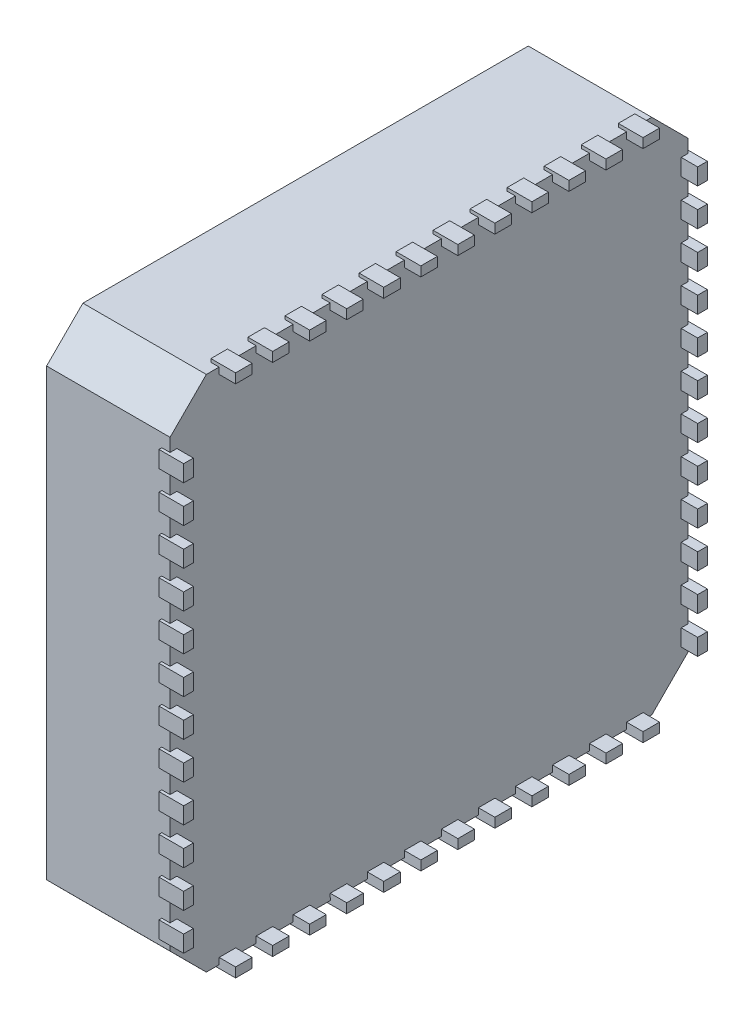
from build123d import *

# Parameters (mm, degrees)
BOSS_EXTRUDE1_DEPTH         = 1.5
BOSS_EXTRUDE2_DEPTH         = 0.2
BOSS_EXTRUDE2_DEPTH_BACK    = 0.1
SKETCH3_W                   = 0.201171233
SKETCH3_H                   = 0.116462587
BOSS_EXTRUDE2_2_DEPTH       = 0.2
BOSS_EXTRUDE2_2_DEPTH_BACK  = 0.1
BOSS_EXTRUDE2_3_DEPTH       = 0.2
BOSS_EXTRUDE2_3_DEPTH_BACK  = 0.1
BOSS_EXTRUDE2_4_DEPTH       = 0.2
BOSS_EXTRUDE2_4_DEPTH_BACK  = 0.1
BOSS_EXTRUDE2_5_DEPTH       = 0.2
BOSS_EXTRUDE2_5_DEPTH_BACK  = 0.1
BOSS_EXTRUDE2_6_DEPTH       = 0.2
BOSS_EXTRUDE2_6_DEPTH_BACK  = 0.1
BOSS_EXTRUDE2_7_DEPTH       = 0.2
BOSS_EXTRUDE2_7_DEPTH_BACK  = 0.1
BOSS_EXTRUDE2_8_DEPTH       = 0.2
BOSS_EXTRUDE2_8_DEPTH_BACK  = 0.1
BOSS_EXTRUDE2_9_DEPTH       = 0.2
BOSS_EXTRUDE2_9_DEPTH_BACK  = 0.1
BOSS_EXTRUDE2_10_DEPTH      = 0.2
BOSS_EXTRUDE2_10_DEPTH_BACK = 0.1
BOSS_EXTRUDE2_11_DEPTH      = 0.2
BOSS_EXTRUDE2_11_DEPTH_BACK = 0.1
BOSS_EXTRUDE2_12_DEPTH      = 0.2
BOSS_EXTRUDE2_12_DEPTH_BACK = 0.1
BOSS_EXTRUDE2_13_DEPTH      = 0.2
BOSS_EXTRUDE2_13_DEPTH_BACK = 0.1
BOSS_EXTRUDE2_14_DEPTH      = 0.2
BOSS_EXTRUDE2_14_DEPTH_BACK = 0.1
BOSS_EXTRUDE2_15_DEPTH      = 0.2
BOSS_EXTRUDE2_15_DEPTH_BACK = 0.1
BOSS_EXTRUDE2_16_DEPTH      = 0.2
BOSS_EXTRUDE2_16_DEPTH_BACK = 0.1
BOSS_EXTRUDE2_17_DEPTH      = 0.2
BOSS_EXTRUDE2_17_DEPTH_BACK = 0.1
BOSS_EXTRUDE2_18_DEPTH      = 0.2
BOSS_EXTRUDE2_18_DEPTH_BACK = 0.1
BOSS_EXTRUDE2_19_DEPTH      = 0.2
BOSS_EXTRUDE2_19_DEPTH_BACK = 0.1
BOSS_EXTRUDE2_20_DEPTH      = 0.2
BOSS_EXTRUDE2_20_DEPTH_BACK = 0.1
BOSS_EXTRUDE2_21_DEPTH      = 0.2
BOSS_EXTRUDE2_21_DEPTH_BACK = 0.1
BOSS_EXTRUDE2_22_DEPTH      = 0.2
BOSS_EXTRUDE2_22_DEPTH_BACK = 0.1
BOSS_EXTRUDE2_23_DEPTH      = 0.2
BOSS_EXTRUDE2_23_DEPTH_BACK = 0.1
BOSS_EXTRUDE2_24_DEPTH      = 0.2
BOSS_EXTRUDE2_24_DEPTH_BACK = 0.1
BOSS_EXTRUDE2_25_DEPTH      = 0.2
BOSS_EXTRUDE2_25_DEPTH_BACK = 0.1
SKETCH3_W_2                 = 0.118473401
SKETCH3_H_2                 = 0.202033004
BOSS_EXTRUDE2_26_DEPTH      = 0.2
BOSS_EXTRUDE2_26_DEPTH_BACK = 0.1
BOSS_EXTRUDE2_27_DEPTH      = 0.2
BOSS_EXTRUDE2_27_DEPTH_BACK = 0.1
BOSS_EXTRUDE2_28_DEPTH      = 0.2
BOSS_EXTRUDE2_28_DEPTH_BACK = 0.1
BOSS_EXTRUDE2_29_DEPTH      = 0.2
BOSS_EXTRUDE2_29_DEPTH_BACK = 0.1
BOSS_EXTRUDE2_30_DEPTH      = 0.2
BOSS_EXTRUDE2_30_DEPTH_BACK = 0.1
BOSS_EXTRUDE2_31_DEPTH      = 0.2
BOSS_EXTRUDE2_31_DEPTH_BACK = 0.1
BOSS_EXTRUDE2_32_DEPTH      = 0.2
BOSS_EXTRUDE2_32_DEPTH_BACK = 0.1
BOSS_EXTRUDE2_33_DEPTH      = 0.2
BOSS_EXTRUDE2_33_DEPTH_BACK = 0.1
BOSS_EXTRUDE2_34_DEPTH      = 0.2
BOSS_EXTRUDE2_34_DEPTH_BACK = 0.1
BOSS_EXTRUDE2_35_DEPTH      = 0.2
BOSS_EXTRUDE2_35_DEPTH_BACK = 0.1
BOSS_EXTRUDE2_36_DEPTH      = 0.2
BOSS_EXTRUDE2_36_DEPTH_BACK = 0.1
BOSS_EXTRUDE2_37_DEPTH      = 0.2
BOSS_EXTRUDE2_37_DEPTH_BACK = 0.1
BOSS_EXTRUDE2_38_DEPTH      = 0.2
BOSS_EXTRUDE2_38_DEPTH_BACK = 0.1
BOSS_EXTRUDE2_39_DEPTH      = 0.2
BOSS_EXTRUDE2_39_DEPTH_BACK = 0.1
BOSS_EXTRUDE2_40_DEPTH      = 0.2
BOSS_EXTRUDE2_40_DEPTH_BACK = 0.1
BOSS_EXTRUDE2_41_DEPTH      = 0.2
BOSS_EXTRUDE2_41_DEPTH_BACK = 0.1
BOSS_EXTRUDE2_42_DEPTH      = 0.2
BOSS_EXTRUDE2_42_DEPTH_BACK = 0.1
BOSS_EXTRUDE2_43_DEPTH      = 0.2
BOSS_EXTRUDE2_43_DEPTH_BACK = 0.1
BOSS_EXTRUDE2_44_DEPTH      = 0.2
BOSS_EXTRUDE2_44_DEPTH_BACK = 0.1
BOSS_EXTRUDE2_45_DEPTH      = 0.2
BOSS_EXTRUDE2_45_DEPTH_BACK = 0.1
BOSS_EXTRUDE2_46_DEPTH      = 0.2
BOSS_EXTRUDE2_46_DEPTH_BACK = 0.1
BOSS_EXTRUDE2_47_DEPTH      = 0.2
BOSS_EXTRUDE2_47_DEPTH_BACK = 0.1
BOSS_EXTRUDE2_48_DEPTH      = 0.2
BOSS_EXTRUDE2_48_DEPTH_BACK = 0.1


with BuildPart() as part:
    # Sketch1 → Boss-Extrude1 (new body)
    with BuildSketch(Plane(origin=(0, 0, 0), x_dir=(0, 0, -1), z_dir=(1, 0, 0))):
        Polygon((-2.705745169, 3.144352607), (2.705745169, 3.144352607), (3.146576543, 2.703521232), (3.146576543, -2.703158576), (2.706107824, -3.144352308), (-2.706107824, -3.144352308), (-3.146576543, -2.703158576), (-3.146576543, 2.703521232), align=None)
    extrude(amount=BOSS_EXTRUDE1_DEPTH)


with BuildPart() as body_2:
    # Sketch3 → Boss-Extrude2 (new, two sides: drawn at the far end of the back side and taken through both)
    with BuildSketch(Plane(origin=(1.5, 0, 0), x_dir=(0, 0, -1), z_dir=(1, 0, 0)).offset(-BOSS_EXTRUDE2_DEPTH_BACK)):
        with Locations((-2.000142358, 3.125490057)):
            Rectangle(SKETCH3_W, SKETCH3_H)
    extrude(amount=BOSS_EXTRUDE2_DEPTH + BOSS_EXTRUDE2_DEPTH_BACK)


with BuildPart() as body_3:
    # Sketch3 → Boss-Extrude2 2 (new, two sides: drawn at the far end of the back side and taken through both)
    with BuildSketch(Plane(origin=(1.5, 0, 0), x_dir=(0, 0, -1), z_dir=(1, 0, 0)).offset(-BOSS_EXTRUDE2_2_DEPTH_BACK)):
        with Locations((-2.450142357, 3.125490057)):
            Rectangle(SKETCH3_W, SKETCH3_H)
    extrude(amount=BOSS_EXTRUDE2_2_DEPTH + BOSS_EXTRUDE2_2_DEPTH_BACK)


with BuildPart() as body_4:
    # Sketch3 → Boss-Extrude2 3 (new, two sides: drawn at the far end of the back side and taken through both)
    with BuildSketch(Plane(origin=(1.5, 0, 0), x_dir=(0, 0, -1), z_dir=(1, 0, 0)).offset(-BOSS_EXTRUDE2_3_DEPTH_BACK)):
        with Locations((-1.550142357, 3.125490057)):
            Rectangle(SKETCH3_W, SKETCH3_H)
    extrude(amount=BOSS_EXTRUDE2_3_DEPTH + BOSS_EXTRUDE2_3_DEPTH_BACK)


with BuildPart() as body_5:
    # Sketch3 → Boss-Extrude2 4 (new, two sides: drawn at the far end of the back side and taken through both)
    with BuildSketch(Plane(origin=(1.5, 0, 0), x_dir=(0, 0, -1), z_dir=(1, 0, 0)).offset(-BOSS_EXTRUDE2_4_DEPTH_BACK)):
        with Locations((-1.100142358, 3.125490057)):
            Rectangle(SKETCH3_W, SKETCH3_H)
    extrude(amount=BOSS_EXTRUDE2_4_DEPTH + BOSS_EXTRUDE2_4_DEPTH_BACK)


with BuildPart() as body_6:
    # Sketch3 → Boss-Extrude2 5 (new, two sides: drawn at the far end of the back side and taken through both)
    with BuildSketch(Plane(origin=(1.5, 0, 0), x_dir=(0, 0, -1), z_dir=(1, 0, 0)).offset(-BOSS_EXTRUDE2_5_DEPTH_BACK)):
        with Locations((-0.650142358, 3.125490057)):
            Rectangle(SKETCH3_W, SKETCH3_H)
    extrude(amount=BOSS_EXTRUDE2_5_DEPTH + BOSS_EXTRUDE2_5_DEPTH_BACK)


with BuildPart() as body_7:
    # Sketch3 → Boss-Extrude2 6 (new, two sides: drawn at the far end of the back side and taken through both)
    with BuildSketch(Plane(origin=(1.5, 0, 0), x_dir=(0, 0, -1), z_dir=(1, 0, 0)).offset(-BOSS_EXTRUDE2_6_DEPTH_BACK)):
        with Locations((-0.200142358, 3.125490057)):
            Rectangle(SKETCH3_W, SKETCH3_H)
    extrude(amount=BOSS_EXTRUDE2_6_DEPTH + BOSS_EXTRUDE2_6_DEPTH_BACK)


with BuildPart() as body_8:
    # Sketch3 → Boss-Extrude2 7 (new, two sides: drawn at the far end of the back side and taken through both)
    with BuildSketch(Plane(origin=(1.5, 0, 0), x_dir=(0, 0, -1), z_dir=(1, 0, 0)).offset(-BOSS_EXTRUDE2_7_DEPTH_BACK)):
        with Locations((0.249857643, 3.125490057)):
            Rectangle(SKETCH3_W, SKETCH3_H)
    extrude(amount=BOSS_EXTRUDE2_7_DEPTH + BOSS_EXTRUDE2_7_DEPTH_BACK)


with BuildPart() as body_9:
    # Sketch3 → Boss-Extrude2 8 (new, two sides: drawn at the far end of the back side and taken through both)
    with BuildSketch(Plane(origin=(1.5, 0, 0), x_dir=(0, 0, -1), z_dir=(1, 0, 0)).offset(-BOSS_EXTRUDE2_8_DEPTH_BACK)):
        with Locations((0.699857643, 3.125490057)):
            Rectangle(SKETCH3_W, SKETCH3_H)
    extrude(amount=BOSS_EXTRUDE2_8_DEPTH + BOSS_EXTRUDE2_8_DEPTH_BACK)


with BuildPart() as body_10:
    # Sketch3 → Boss-Extrude2 9 (new, two sides: drawn at the far end of the back side and taken through both)
    with BuildSketch(Plane(origin=(1.5, 0, 0), x_dir=(0, 0, -1), z_dir=(1, 0, 0)).offset(-BOSS_EXTRUDE2_9_DEPTH_BACK)):
        with Locations((1.149857643, 3.125490057)):
            Rectangle(SKETCH3_W, SKETCH3_H)
    extrude(amount=BOSS_EXTRUDE2_9_DEPTH + BOSS_EXTRUDE2_9_DEPTH_BACK)


with BuildPart() as body_11:
    # Sketch3 → Boss-Extrude2 10 (new, two sides: drawn at the far end of the back side and taken through both)
    with BuildSketch(Plane(origin=(1.5, 0, 0), x_dir=(0, 0, -1), z_dir=(1, 0, 0)).offset(-BOSS_EXTRUDE2_10_DEPTH_BACK)):
        with Locations((1.599857642, 3.125490057)):
            Rectangle(SKETCH3_W, SKETCH3_H)
    extrude(amount=BOSS_EXTRUDE2_10_DEPTH + BOSS_EXTRUDE2_10_DEPTH_BACK)


with BuildPart() as body_12:
    # Sketch3 → Boss-Extrude2 11 (new, two sides: drawn at the far end of the back side and taken through both)
    with BuildSketch(Plane(origin=(1.5, 0, 0), x_dir=(0, 0, -1), z_dir=(1, 0, 0)).offset(-BOSS_EXTRUDE2_11_DEPTH_BACK)):
        with Locations((2.049857643, 3.125490057)):
            Rectangle(SKETCH3_W, SKETCH3_H)
    extrude(amount=BOSS_EXTRUDE2_11_DEPTH + BOSS_EXTRUDE2_11_DEPTH_BACK)


with BuildPart() as body_13:
    # Sketch3 → Boss-Extrude2 12 (new, two sides: drawn at the far end of the back side and taken through both)
    with BuildSketch(Plane(origin=(1.5, 0, 0), x_dir=(0, 0, -1), z_dir=(1, 0, 0)).offset(-BOSS_EXTRUDE2_12_DEPTH_BACK)):
        with Locations((2.499857643, 3.125490057)):
            Rectangle(SKETCH3_W, SKETCH3_H)
    extrude(amount=BOSS_EXTRUDE2_12_DEPTH + BOSS_EXTRUDE2_12_DEPTH_BACK)


with BuildPart() as body_14:
    # Sketch3 → Boss-Extrude2 13 (new, two sides: drawn at the far end of the back side and taken through both)
    with BuildSketch(Plane(origin=(1.5, 0, 0), x_dir=(0, 0, -1), z_dir=(1, 0, 0)).offset(-BOSS_EXTRUDE2_13_DEPTH_BACK)):
        Polygon((2.399638947, -3.183444803), (2.399625524, -3.066982217), (2.600796756, -3.066959031), (2.600810178, -3.183421617), align=None)
    extrude(amount=BOSS_EXTRUDE2_13_DEPTH + BOSS_EXTRUDE2_13_DEPTH_BACK)


with BuildPart() as body_15:
    # Sketch3 → Boss-Extrude2 14 (new, two sides: drawn at the far end of the back side and taken through both)
    with BuildSketch(Plane(origin=(1.5, 0, 0), x_dir=(0, 0, -1), z_dir=(1, 0, 0)).offset(-BOSS_EXTRUDE2_14_DEPTH_BACK)):
        Polygon((1.94963895, -3.183496668), (1.949625527, -3.067034081), (2.150796759, -3.067010895), (2.150810181, -3.183473482), align=None)
    extrude(amount=BOSS_EXTRUDE2_14_DEPTH + BOSS_EXTRUDE2_14_DEPTH_BACK)


with BuildPart() as body_16:
    # Sketch3 → Boss-Extrude2 15 (new, two sides: drawn at the far end of the back side and taken through both)
    with BuildSketch(Plane(origin=(1.5, 0, 0), x_dir=(0, 0, -1), z_dir=(1, 0, 0)).offset(-BOSS_EXTRUDE2_15_DEPTH_BACK)):
        Polygon((1.499638953, -3.183548532), (1.49962553, -3.067085945), (1.700796762, -3.067062759), (1.700810184, -3.183525346), align=None)
    extrude(amount=BOSS_EXTRUDE2_15_DEPTH + BOSS_EXTRUDE2_15_DEPTH_BACK)


with BuildPart() as body_17:
    # Sketch3 → Boss-Extrude2 16 (new, two sides: drawn at the far end of the back side and taken through both)
    with BuildSketch(Plane(origin=(1.5, 0, 0), x_dir=(0, 0, -1), z_dir=(1, 0, 0)).offset(-BOSS_EXTRUDE2_16_DEPTH_BACK)):
        Polygon((1.049638956, -3.183600396), (1.049625533, -3.067137809), (1.250796765, -3.067114624), (1.250810187, -3.18357721), align=None)
    extrude(amount=BOSS_EXTRUDE2_16_DEPTH + BOSS_EXTRUDE2_16_DEPTH_BACK)


with BuildPart() as body_18:
    # Sketch3 → Boss-Extrude2 17 (new, two sides: drawn at the far end of the back side and taken through both)
    with BuildSketch(Plane(origin=(1.5, 0, 0), x_dir=(0, 0, -1), z_dir=(1, 0, 0)).offset(-BOSS_EXTRUDE2_17_DEPTH_BACK)):
        Polygon((0.599638959, -3.18365226), (0.599625536, -3.067189674), (0.800796768, -3.067166488), (0.80081019, -3.183629075), align=None)
    extrude(amount=BOSS_EXTRUDE2_17_DEPTH + BOSS_EXTRUDE2_17_DEPTH_BACK)


with BuildPart() as body_19:
    # Sketch3 → Boss-Extrude2 18 (new, two sides: drawn at the far end of the back side and taken through both)
    with BuildSketch(Plane(origin=(1.5, 0, 0), x_dir=(0, 0, -1), z_dir=(1, 0, 0)).offset(-BOSS_EXTRUDE2_18_DEPTH_BACK)):
        Polygon((0.149638962, -3.183704125), (0.149625539, -3.067241538), (0.350796771, -3.067218352), (0.350810193, -3.183680939), align=None)
    extrude(amount=BOSS_EXTRUDE2_18_DEPTH + BOSS_EXTRUDE2_18_DEPTH_BACK)


with BuildPart() as body_20:
    # Sketch3 → Boss-Extrude2 19 (new, two sides: drawn at the far end of the back side and taken through both)
    with BuildSketch(Plane(origin=(1.5, 0, 0), x_dir=(0, 0, -1), z_dir=(1, 0, 0)).offset(-BOSS_EXTRUDE2_19_DEPTH_BACK)):
        Polygon((-0.300361035, -3.183755989), (-0.300374458, -3.067293402), (-0.099203226, -3.067270217), (-0.099189804, -3.183732803), align=None)
    extrude(amount=BOSS_EXTRUDE2_19_DEPTH + BOSS_EXTRUDE2_19_DEPTH_BACK)


with BuildPart() as body_21:
    # Sketch3 → Boss-Extrude2 20 (new, two sides: drawn at the far end of the back side and taken through both)
    with BuildSketch(Plane(origin=(1.5, 0, 0), x_dir=(0, 0, -1), z_dir=(1, 0, 0)).offset(-BOSS_EXTRUDE2_20_DEPTH_BACK)):
        Polygon((-0.750361032, -3.183807853), (-0.750374455, -3.067345267), (-0.549203223, -3.067322081), (-0.549189801, -3.183784668), align=None)
    extrude(amount=BOSS_EXTRUDE2_20_DEPTH + BOSS_EXTRUDE2_20_DEPTH_BACK)


with BuildPart() as body_22:
    # Sketch3 → Boss-Extrude2 21 (new, two sides: drawn at the far end of the back side and taken through both)
    with BuildSketch(Plane(origin=(1.5, 0, 0), x_dir=(0, 0, -1), z_dir=(1, 0, 0)).offset(-BOSS_EXTRUDE2_21_DEPTH_BACK)):
        Polygon((-1.200361029, -3.183859718), (-1.200374452, -3.067397131), (-0.99920322, -3.067373945), (-0.999189798, -3.183836532), align=None)
    extrude(amount=BOSS_EXTRUDE2_21_DEPTH + BOSS_EXTRUDE2_21_DEPTH_BACK)


with BuildPart() as body_23:
    # Sketch3 → Boss-Extrude2 22 (new, two sides: drawn at the far end of the back side and taken through both)
    with BuildSketch(Plane(origin=(1.5, 0, 0), x_dir=(0, 0, -1), z_dir=(1, 0, 0)).offset(-BOSS_EXTRUDE2_22_DEPTH_BACK)):
        Polygon((-1.650361026, -3.183911582), (-1.650374449, -3.067448995), (-1.449203217, -3.067425809), (-1.449189795, -3.183888396), align=None)
    extrude(amount=BOSS_EXTRUDE2_22_DEPTH + BOSS_EXTRUDE2_22_DEPTH_BACK)


with BuildPart() as body_24:
    # Sketch3 → Boss-Extrude2 23 (new, two sides: drawn at the far end of the back side and taken through both)
    with BuildSketch(Plane(origin=(1.5, 0, 0), x_dir=(0, 0, -1), z_dir=(1, 0, 0)).offset(-BOSS_EXTRUDE2_23_DEPTH_BACK)):
        Polygon((-2.100361023, -3.183963446), (-2.100374446, -3.06750086), (-1.899203214, -3.067477674), (-1.899189792, -3.18394026), align=None)
    extrude(amount=BOSS_EXTRUDE2_23_DEPTH + BOSS_EXTRUDE2_23_DEPTH_BACK)


with BuildPart() as body_25:
    # Sketch3 → Boss-Extrude2 24 (new, two sides: drawn at the far end of the back side and taken through both)
    with BuildSketch(Plane(origin=(1.5, 0, 0), x_dir=(0, 0, -1), z_dir=(1, 0, 0)).offset(-BOSS_EXTRUDE2_24_DEPTH_BACK)):
        Polygon((-2.55036102, -3.184015311), (-2.550374443, -3.067552724), (-2.349203211, -3.067529538), (-2.349189789, -3.183992125), align=None)
    extrude(amount=BOSS_EXTRUDE2_24_DEPTH + BOSS_EXTRUDE2_24_DEPTH_BACK)


with BuildPart() as body_26:
    # Sketch3 → Boss-Extrude2 25 (new, two sides: drawn at the far end of the back side and taken through both)
    with BuildSketch(Plane(origin=(1.5, 0, 0), x_dir=(0, 0, -1), z_dir=(1, 0, 0)).offset(-BOSS_EXTRUDE2_25_DEPTH_BACK)):
        with Locations((3.122594305, 1.99250473)):
            Rectangle(SKETCH3_W_2, SKETCH3_H_2)
    extrude(amount=BOSS_EXTRUDE2_25_DEPTH + BOSS_EXTRUDE2_25_DEPTH_BACK)


with BuildPart() as body_27:
    # Sketch3 → Boss-Extrude2 26 (new, two sides: drawn at the far end of the back side and taken through both)
    with BuildSketch(Plane(origin=(1.5, 0, 0), x_dir=(0, 0, -1), z_dir=(1, 0, 0)).offset(-BOSS_EXTRUDE2_26_DEPTH_BACK)):
        with Locations((3.122594305, 2.44250473)):
            Rectangle(SKETCH3_W_2, SKETCH3_H_2)
    extrude(amount=BOSS_EXTRUDE2_26_DEPTH + BOSS_EXTRUDE2_26_DEPTH_BACK)


with BuildPart() as body_28:
    # Sketch3 → Boss-Extrude2 27 (new, two sides: drawn at the far end of the back side and taken through both)
    with BuildSketch(Plane(origin=(1.5, 0, 0), x_dir=(0, 0, -1), z_dir=(1, 0, 0)).offset(-BOSS_EXTRUDE2_27_DEPTH_BACK)):
        with Locations((3.122594305, 1.54250473)):
            Rectangle(SKETCH3_W_2, SKETCH3_H_2)
    extrude(amount=BOSS_EXTRUDE2_27_DEPTH + BOSS_EXTRUDE2_27_DEPTH_BACK)


with BuildPart() as body_29:
    # Sketch3 → Boss-Extrude2 28 (new, two sides: drawn at the far end of the back side and taken through both)
    with BuildSketch(Plane(origin=(1.5, 0, 0), x_dir=(0, 0, -1), z_dir=(1, 0, 0)).offset(-BOSS_EXTRUDE2_28_DEPTH_BACK)):
        with Locations((3.122594305, 1.09250473)):
            Rectangle(SKETCH3_W_2, SKETCH3_H_2)
    extrude(amount=BOSS_EXTRUDE2_28_DEPTH + BOSS_EXTRUDE2_28_DEPTH_BACK)


with BuildPart() as body_30:
    # Sketch3 → Boss-Extrude2 29 (new, two sides: drawn at the far end of the back side and taken through both)
    with BuildSketch(Plane(origin=(1.5, 0, 0), x_dir=(0, 0, -1), z_dir=(1, 0, 0)).offset(-BOSS_EXTRUDE2_29_DEPTH_BACK)):
        with Locations((3.122594305, 0.64250473)):
            Rectangle(SKETCH3_W_2, SKETCH3_H_2)
    extrude(amount=BOSS_EXTRUDE2_29_DEPTH + BOSS_EXTRUDE2_29_DEPTH_BACK)


with BuildPart() as body_31:
    # Sketch3 → Boss-Extrude2 30 (new, two sides: drawn at the far end of the back side and taken through both)
    with BuildSketch(Plane(origin=(1.5, 0, 0), x_dir=(0, 0, -1), z_dir=(1, 0, 0)).offset(-BOSS_EXTRUDE2_30_DEPTH_BACK)):
        with Locations((3.122594305, 0.19250473)):
            Rectangle(SKETCH3_W_2, SKETCH3_H_2)
    extrude(amount=BOSS_EXTRUDE2_30_DEPTH + BOSS_EXTRUDE2_30_DEPTH_BACK)


with BuildPart() as body_32:
    # Sketch3 → Boss-Extrude2 31 (new, two sides: drawn at the far end of the back side and taken through both)
    with BuildSketch(Plane(origin=(1.5, 0, 0), x_dir=(0, 0, -1), z_dir=(1, 0, 0)).offset(-BOSS_EXTRUDE2_31_DEPTH_BACK)):
        with Locations((3.122594305, -0.25749527)):
            Rectangle(SKETCH3_W_2, SKETCH3_H_2)
    extrude(amount=BOSS_EXTRUDE2_31_DEPTH + BOSS_EXTRUDE2_31_DEPTH_BACK)


with BuildPart() as body_33:
    # Sketch3 → Boss-Extrude2 32 (new, two sides: drawn at the far end of the back side and taken through both)
    with BuildSketch(Plane(origin=(1.5, 0, 0), x_dir=(0, 0, -1), z_dir=(1, 0, 0)).offset(-BOSS_EXTRUDE2_32_DEPTH_BACK)):
        with Locations((3.122594305, -0.70749527)):
            Rectangle(SKETCH3_W_2, SKETCH3_H_2)
    extrude(amount=BOSS_EXTRUDE2_32_DEPTH + BOSS_EXTRUDE2_32_DEPTH_BACK)


with BuildPart() as body_34:
    # Sketch3 → Boss-Extrude2 33 (new, two sides: drawn at the far end of the back side and taken through both)
    with BuildSketch(Plane(origin=(1.5, 0, 0), x_dir=(0, 0, -1), z_dir=(1, 0, 0)).offset(-BOSS_EXTRUDE2_33_DEPTH_BACK)):
        with Locations((3.122594305, -1.15749527)):
            Rectangle(SKETCH3_W_2, SKETCH3_H_2)
    extrude(amount=BOSS_EXTRUDE2_33_DEPTH + BOSS_EXTRUDE2_33_DEPTH_BACK)


with BuildPart() as body_35:
    # Sketch3 → Boss-Extrude2 34 (new, two sides: drawn at the far end of the back side and taken through both)
    with BuildSketch(Plane(origin=(1.5, 0, 0), x_dir=(0, 0, -1), z_dir=(1, 0, 0)).offset(-BOSS_EXTRUDE2_34_DEPTH_BACK)):
        with Locations((3.122594305, -1.60749527)):
            Rectangle(SKETCH3_W_2, SKETCH3_H_2)
    extrude(amount=BOSS_EXTRUDE2_34_DEPTH + BOSS_EXTRUDE2_34_DEPTH_BACK)


with BuildPart() as body_36:
    # Sketch3 → Boss-Extrude2 35 (new, two sides: drawn at the far end of the back side and taken through both)
    with BuildSketch(Plane(origin=(1.5, 0, 0), x_dir=(0, 0, -1), z_dir=(1, 0, 0)).offset(-BOSS_EXTRUDE2_35_DEPTH_BACK)):
        with Locations((3.122594305, -2.05749527)):
            Rectangle(SKETCH3_W_2, SKETCH3_H_2)
    extrude(amount=BOSS_EXTRUDE2_35_DEPTH + BOSS_EXTRUDE2_35_DEPTH_BACK)


with BuildPart() as body_37:
    # Sketch3 → Boss-Extrude2 36 (new, two sides: drawn at the far end of the back side and taken through both)
    with BuildSketch(Plane(origin=(1.5, 0, 0), x_dir=(0, 0, -1), z_dir=(1, 0, 0)).offset(-BOSS_EXTRUDE2_36_DEPTH_BACK)):
        with Locations((3.122594305, -2.50749527)):
            Rectangle(SKETCH3_W_2, SKETCH3_H_2)
    extrude(amount=BOSS_EXTRUDE2_36_DEPTH + BOSS_EXTRUDE2_36_DEPTH_BACK)


with BuildPart() as body_38:
    # Sketch3 → Boss-Extrude2 37 (new, two sides: drawn at the far end of the back side and taken through both)
    with BuildSketch(Plane(origin=(1.5, 0, 0), x_dir=(0, 0, -1), z_dir=(1, 0, 0)).offset(-BOSS_EXTRUDE2_37_DEPTH_BACK)):
        with Locations((-3.122594305, -2.50749527)):
            Rectangle(SKETCH3_W_2, SKETCH3_H_2)
    extrude(amount=BOSS_EXTRUDE2_37_DEPTH + BOSS_EXTRUDE2_37_DEPTH_BACK)


with BuildPart() as body_39:
    # Sketch3 → Boss-Extrude2 38 (new, two sides: drawn at the far end of the back side and taken through both)
    with BuildSketch(Plane(origin=(1.5, 0, 0), x_dir=(0, 0, -1), z_dir=(1, 0, 0)).offset(-BOSS_EXTRUDE2_38_DEPTH_BACK)):
        with Locations((-3.122594305, -2.05749527)):
            Rectangle(SKETCH3_W_2, SKETCH3_H_2)
    extrude(amount=BOSS_EXTRUDE2_38_DEPTH + BOSS_EXTRUDE2_38_DEPTH_BACK)


with BuildPart() as body_40:
    # Sketch3 → Boss-Extrude2 39 (new, two sides: drawn at the far end of the back side and taken through both)
    with BuildSketch(Plane(origin=(1.5, 0, 0), x_dir=(0, 0, -1), z_dir=(1, 0, 0)).offset(-BOSS_EXTRUDE2_39_DEPTH_BACK)):
        with Locations((-3.122594305, -1.60749527)):
            Rectangle(SKETCH3_W_2, SKETCH3_H_2)
    extrude(amount=BOSS_EXTRUDE2_39_DEPTH + BOSS_EXTRUDE2_39_DEPTH_BACK)


with BuildPart() as body_41:
    # Sketch3 → Boss-Extrude2 40 (new, two sides: drawn at the far end of the back side and taken through both)
    with BuildSketch(Plane(origin=(1.5, 0, 0), x_dir=(0, 0, -1), z_dir=(1, 0, 0)).offset(-BOSS_EXTRUDE2_40_DEPTH_BACK)):
        with Locations((-3.122594305, -1.15749527)):
            Rectangle(SKETCH3_W_2, SKETCH3_H_2)
    extrude(amount=BOSS_EXTRUDE2_40_DEPTH + BOSS_EXTRUDE2_40_DEPTH_BACK)


with BuildPart() as body_42:
    # Sketch3 → Boss-Extrude2 41 (new, two sides: drawn at the far end of the back side and taken through both)
    with BuildSketch(Plane(origin=(1.5, 0, 0), x_dir=(0, 0, -1), z_dir=(1, 0, 0)).offset(-BOSS_EXTRUDE2_41_DEPTH_BACK)):
        with Locations((-3.122594305, -0.70749527)):
            Rectangle(SKETCH3_W_2, SKETCH3_H_2)
    extrude(amount=BOSS_EXTRUDE2_41_DEPTH + BOSS_EXTRUDE2_41_DEPTH_BACK)


with BuildPart() as body_43:
    # Sketch3 → Boss-Extrude2 42 (new, two sides: drawn at the far end of the back side and taken through both)
    with BuildSketch(Plane(origin=(1.5, 0, 0), x_dir=(0, 0, -1), z_dir=(1, 0, 0)).offset(-BOSS_EXTRUDE2_42_DEPTH_BACK)):
        with Locations((-3.122594305, -0.25749527)):
            Rectangle(SKETCH3_W_2, SKETCH3_H_2)
    extrude(amount=BOSS_EXTRUDE2_42_DEPTH + BOSS_EXTRUDE2_42_DEPTH_BACK)


with BuildPart() as body_44:
    # Sketch3 → Boss-Extrude2 43 (new, two sides: drawn at the far end of the back side and taken through both)
    with BuildSketch(Plane(origin=(1.5, 0, 0), x_dir=(0, 0, -1), z_dir=(1, 0, 0)).offset(-BOSS_EXTRUDE2_43_DEPTH_BACK)):
        with Locations((-3.122594305, 0.19250473)):
            Rectangle(SKETCH3_W_2, SKETCH3_H_2)
    extrude(amount=BOSS_EXTRUDE2_43_DEPTH + BOSS_EXTRUDE2_43_DEPTH_BACK)


with BuildPart() as body_45:
    # Sketch3 → Boss-Extrude2 44 (new, two sides: drawn at the far end of the back side and taken through both)
    with BuildSketch(Plane(origin=(1.5, 0, 0), x_dir=(0, 0, -1), z_dir=(1, 0, 0)).offset(-BOSS_EXTRUDE2_44_DEPTH_BACK)):
        with Locations((-3.122594305, 0.64250473)):
            Rectangle(SKETCH3_W_2, SKETCH3_H_2)
    extrude(amount=BOSS_EXTRUDE2_44_DEPTH + BOSS_EXTRUDE2_44_DEPTH_BACK)


with BuildPart() as body_46:
    # Sketch3 → Boss-Extrude2 45 (new, two sides: drawn at the far end of the back side and taken through both)
    with BuildSketch(Plane(origin=(1.5, 0, 0), x_dir=(0, 0, -1), z_dir=(1, 0, 0)).offset(-BOSS_EXTRUDE2_45_DEPTH_BACK)):
        with Locations((-3.122594305, 1.09250473)):
            Rectangle(SKETCH3_W_2, SKETCH3_H_2)
    extrude(amount=BOSS_EXTRUDE2_45_DEPTH + BOSS_EXTRUDE2_45_DEPTH_BACK)


with BuildPart() as body_47:
    # Sketch3 → Boss-Extrude2 46 (new, two sides: drawn at the far end of the back side and taken through both)
    with BuildSketch(Plane(origin=(1.5, 0, 0), x_dir=(0, 0, -1), z_dir=(1, 0, 0)).offset(-BOSS_EXTRUDE2_46_DEPTH_BACK)):
        with Locations((-3.122594305, 1.54250473)):
            Rectangle(SKETCH3_W_2, SKETCH3_H_2)
    extrude(amount=BOSS_EXTRUDE2_46_DEPTH + BOSS_EXTRUDE2_46_DEPTH_BACK)


with BuildPart() as body_48:
    # Sketch3 → Boss-Extrude2 47 (new, two sides: drawn at the far end of the back side and taken through both)
    with BuildSketch(Plane(origin=(1.5, 0, 0), x_dir=(0, 0, -1), z_dir=(1, 0, 0)).offset(-BOSS_EXTRUDE2_47_DEPTH_BACK)):
        with Locations((-3.122594305, 1.99250473)):
            Rectangle(SKETCH3_W_2, SKETCH3_H_2)
    extrude(amount=BOSS_EXTRUDE2_47_DEPTH + BOSS_EXTRUDE2_47_DEPTH_BACK)


with BuildPart() as body_49:
    # Sketch3 → Boss-Extrude2 48 (new, two sides: drawn at the far end of the back side and taken through both)
    with BuildSketch(Plane(origin=(1.5, 0, 0), x_dir=(0, 0, -1), z_dir=(1, 0, 0)).offset(-BOSS_EXTRUDE2_48_DEPTH_BACK)):
        with Locations((-3.122594305, 2.44250473)):
            Rectangle(SKETCH3_W_2, SKETCH3_H_2)
    extrude(amount=BOSS_EXTRUDE2_48_DEPTH + BOSS_EXTRUDE2_48_DEPTH_BACK)


solid = Compound([part.part, body_2.part, body_3.part, body_4.part, body_5.part, body_6.part, body_7.part, body_8.part, body_9.part, body_10.part, body_11.part, body_12.part, body_13.part, body_14.part, body_15.part, body_16.part, body_17.part, body_18.part, body_19.part, body_20.part, body_21.part, body_22.part, body_23.part, body_24.part, body_25.part, body_26.part, body_27.part, body_28.part, body_29.part, body_30.part, body_31.part, body_32.part, body_33.part, body_34.part, body_35.part, body_36.part, body_37.part, body_38.part, body_39.part, body_40.part, body_41.part, body_42.part, body_43.part, body_44.part, body_45.part, body_46.part, body_47.part, body_48.part, body_49.part])
